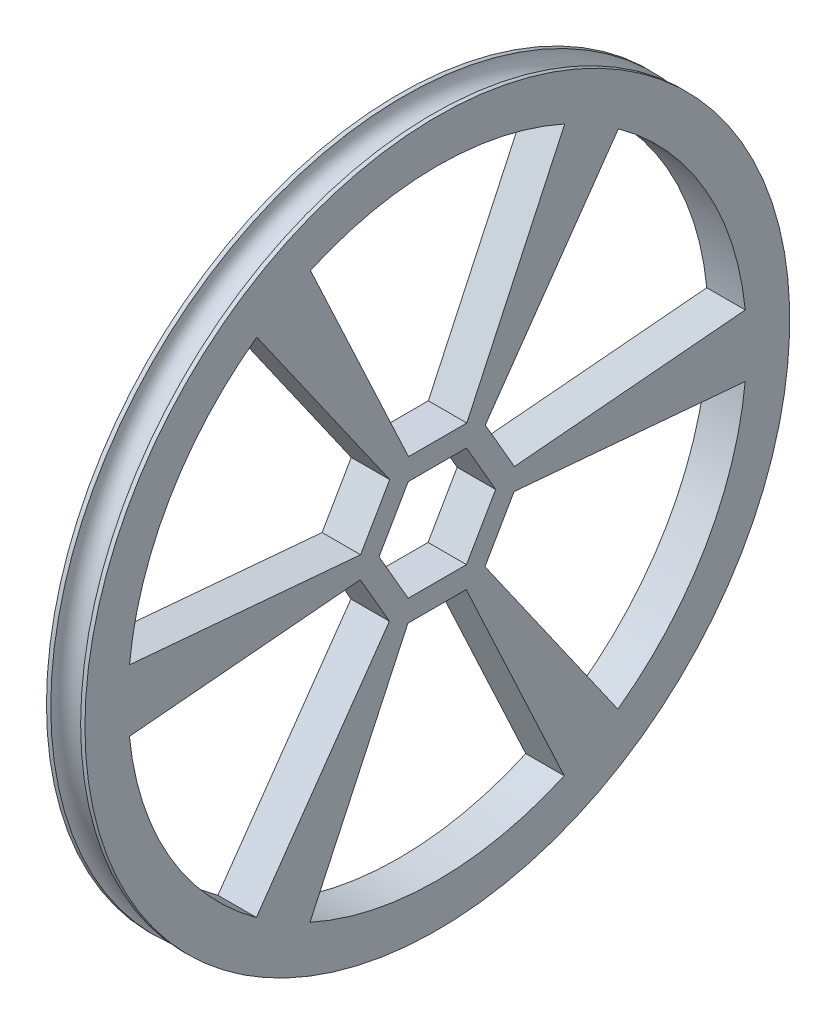
from build123d import *

# Parameters (mm, degrees)
SKETCH2_W          = 0.508
SKETCH2_H          = 41.656
CUT_EXTRUDE1_REACH = 61.086
SKETCH3_R          = 1.651
CIRPATTERN1_COUNT  = 6


with BuildPart() as part:
    # Sketch2 → Revolve1 (revolve)
    with BuildSketch(Plane.XY, mode=Mode.PRIVATE) as revolve1_sk:
        with Locations((-0.254, 20.828)):
            Rectangle(SKETCH2_W, SKETCH2_H)
        with BuildLine():
            ThreePointArc((0, 41.656), (1.7653, 39.8907), (3.5306, 41.656))
            Line((3.5306, 41.656), (3.5306, 0))
            Line((3.5306, 0), (0, 0))
            Line((0, 0), (0, 41.656))
        make_face()
        with Locations((3.7846, 20.828)):
            Rectangle(SKETCH2_W, SKETCH2_H)
    revolve(revolve1_sk.sketch.rotate(Axis((0, 0, 0), (1, 0, 0)), 90), axis=Axis((0, 0, 0), (1, 0, 0)))

    # Sketch3 → Cut-Extrude1 (cut, up to next)
    with BuildSketch(Plane(origin=(-0.508, 0, 0), x_dir=(0, 0, -1), z_dir=(1, 0, 0)), mode=Mode.PRIVATE) as cut_extrude1_sk1:
        with BuildLine():
            ThreePointArc((6.764649654, 21.414174788), (-0.091034511, 22.457049662), (-6.938038467, 21.358627977))
            Line((-6.938038467, 21.358627977), (-3.409234604, 8.509))
            Line((-3.409234604, 8.509), (3.48250762, 8.509))
            Line((3.48250762, 8.509), (6.764649654, 21.414174788))
        make_face()
    cut_extrude1_tool1 = extrude(cut_extrude1_sk1.sketch, amount=CUT_EXTRUDE1_REACH, mode=Mode.PRIVATE) & part.part
    # Sketch3 → Cut-Extrude1 (cut, up to next)
    with BuildSketch(Plane(origin=(-0.508, 0, 0), x_dir=(0, 0, -1), z_dir=(1, 0, 0)), mode=Mode.PRIVATE) as cut_extrude1_sk2:
        with BuildLine():
            Line((6.764649654, 21.414174788), (3.48250762, 8.509))
            Line((3.48250762, 8.509), (15.057941963, 33.332599056))
            ThreePointArc((15.057941963, 33.332599056), (0.03320673, 36.575984926), (-14.997392963, 33.359885796))
            Line((-14.997392963, 33.359885796), (-3.409234604, 8.509))
            Line((-3.409234604, 8.509), (-6.938038467, 21.358627977))
            ThreePointArc((-6.938038467, 21.358627977), (-0.091034511, 22.457049662), (6.764649654, 21.414174788))
        make_face()
    cut_extrude1_tool2 = extrude(cut_extrude1_sk2.sketch, amount=CUT_EXTRUDE1_REACH, mode=Mode.PRIVATE) & part.part
    # Sketch3 → Cut-Extrude1 (cut, up to next)
    with BuildSketch(Plane(origin=(-0.508, 0, 0), x_dir=(0, 0, -1), z_dir=(1, 0, 0)), mode=Mode.PRIVATE) as cut_extrude1_sk3:
        Polygon((6.892407514, 0), (3.446203757, 5.969), (-3.446203757, 5.969), (-6.892407514, 0), (-3.446203757, -5.969), (3.446203757, -5.969), align=None)
        Circle(SKETCH3_R, mode=Mode.SUBTRACT)
    cut_extrude1_tool3 = extrude(cut_extrude1_sk3.sketch, amount=CUT_EXTRUDE1_REACH, mode=Mode.PRIVATE) & part.part
    # Sketch3 → Cut-Extrude1 (cut, up to next)
    with BuildSketch(Plane(origin=(-0.508, 0, 0), x_dir=(0, 0, -1), z_dir=(1, 0, 0)), mode=Mode.PRIVATE) as cut_extrude1_sk4:
        Circle(SKETCH3_R)
    cut_extrude1_tool4 = extrude(cut_extrude1_sk4.sketch, amount=CUT_EXTRUDE1_REACH, mode=Mode.PRIVATE) & part.part
    cut_extrude1_1 = cut_extrude1_tool1.solids().sort_by_distance((-0.508, 16.082461, 0.033427))[0]
    add(cut_extrude1_1, mode=Mode.SUBTRACT)
    cut_extrude1_2 = cut_extrude1_tool2.solids().sort_by_distance((-0.508, 28.201859, -0.056512))[0]
    add(cut_extrude1_2, mode=Mode.SUBTRACT)
    cut_extrude1_3 = cut_extrude1_tool3.solids().sort_by_distance((-0.508, 2.893322, -5.011381))[0]
    add(cut_extrude1_3, mode=Mode.SUBTRACT)
    cut_extrude1_4 = cut_extrude1_tool4.solids().sort_by_distance((-0.508, 0, 0))[0]
    add(cut_extrude1_4, mode=Mode.SUBTRACT)
    cut_extrude1 = cut_extrude1_1 + cut_extrude1_2 + cut_extrude1_3 + cut_extrude1_4  # Cut-Extrude1 as one shape, for the pattern or mirror that repeats it

    # CirPattern1: Cut-Extrude1 ×6 about axis
    cirpattern1_axis = Axis((0, 0, 0), (1, 0, 0))
    for i in range(1, CIRPATTERN1_COUNT):
        add(cut_extrude1.rotate(cirpattern1_axis, i * 360 / CIRPATTERN1_COUNT), mode=Mode.SUBTRACT)


solid = part.part
